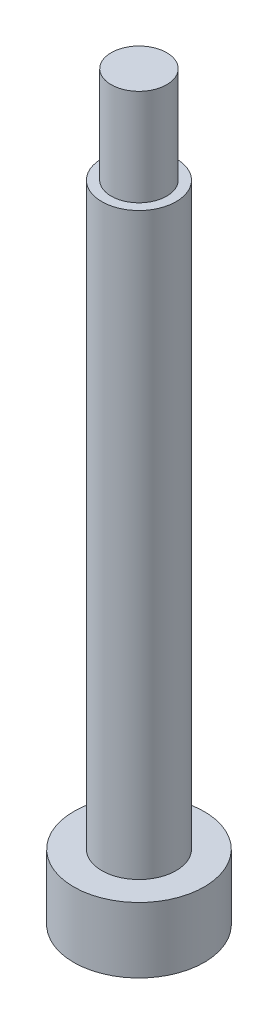
from build123d import *

# Parameters (mm, degrees)
SKETCH1_R           = 3.43535
BOSS_EXTRUDE1_DEPTH = 3.4417
SKETCH2_R           = 1.9558
BOSS_EXTRUDE2_DEPTH = 30.48
SKETCH3_R           = 1.4605
BOSS_EXTRUDE3_DEPTH = 5.08


with BuildPart() as part:
    # Sketch1 → Boss-Extrude1 (new body)
    with BuildSketch(Plane(origin=(0, 0, 0), x_dir=(1, 0, 0), z_dir=(0, 1, 0))):
        with Locations(Location((0, 0, 0), (0, 0, 270))):
            Circle(SKETCH1_R)
    extrude(amount=BOSS_EXTRUDE1_DEPTH)

    # Sketch2 → Boss-Extrude2 (add)
    with BuildSketch(Plane(origin=(0, 3.4417, 0), x_dir=(1, 0, 0), z_dir=(0, 1, 0))):
        with Locations(Location((0, 0, 0), (0, 0, 90))):
            Circle(SKETCH2_R)
    extrude(amount=BOSS_EXTRUDE2_DEPTH)

    # Sketch3 → Boss-Extrude3 (add)
    with BuildSketch(Plane(origin=(0, 33.9217, 0), x_dir=(1, 0, 0), z_dir=(0, 1, 0))):
        with Locations(Location((0, 0, 0), (0, 0, 270))):
            Circle(SKETCH3_R)
    extrude(amount=BOSS_EXTRUDE3_DEPTH)


solid = part.part
